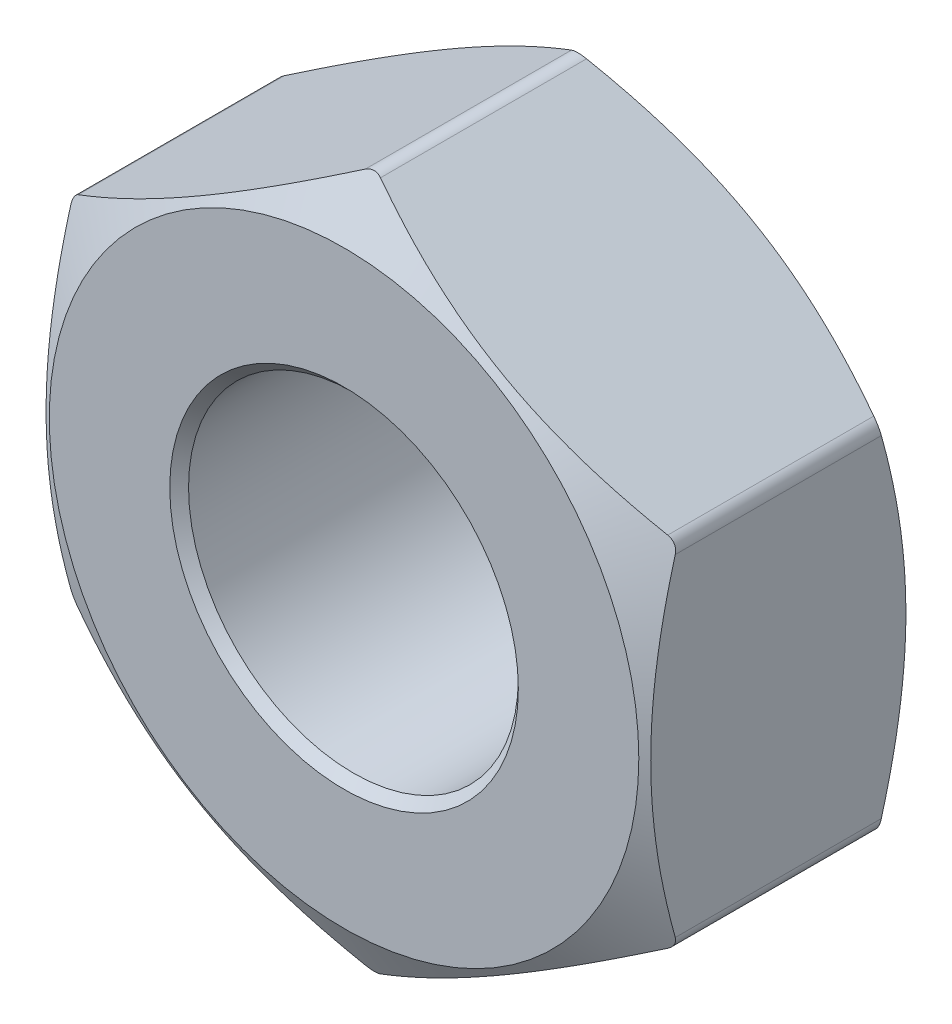
from build123d import *

# Parameters (mm, degrees)
BOSS_EXTRUDE1_DEPTH      = 1.2
BOSS_EXTRUDE1_DEPTH_BACK = 1.2
SKETCH2_R                = 1.5
SKETCH3_OUTSIDE_W        = 29.47
SKETCH3_OUTSIDE_H        = 30.32
SKETCH3_OUTSIDE_R        = 2.68125
CUT_EXTRUDE1_DEPTH       = 5.837957558
CUT_EXTRUDE1_DRAFT       = -60
FILLET1_R                = 0.1375
MIRROR1_COPY_1_SKETCH_W  = 29.47
MIRROR1_COPY_1_SKETCH_H  = 30.32
MIRROR1_COPY_1_SKETCH_R  = 2.68125
MIRROR1_COPY_1_DEPTH     = 5.837957558
MIRROR1_COPY_1_DRAFT     = -60


with BuildPart() as part:
    # Sketch2 → Boss-Extrude1 (new, two sides: drawn at the far end of the back side and taken through both)
    with BuildSketch(Plane.XY.offset(-BOSS_EXTRUDE1_DEPTH_BACK)):
        Polygon((0, 3.175426481), (-2.75, 1.58771324), (-2.75, -1.58771324), (0, -3.175426481), (2.75, -1.58771324), (2.75, 1.58771324), align=None)
        Circle(SKETCH2_R, mode=Mode.SUBTRACT)
    extrude(amount=BOSS_EXTRUDE1_DEPTH + BOSS_EXTRUDE1_DEPTH_BACK)


with BuildPart() as cut_extrude1_tool:
    # Sketch3 outside → Cut-Extrude1 (with draft: the straight prism first)
    with BuildSketch(Plane.XY.offset(1.2)):
        Rectangle(SKETCH3_OUTSIDE_W, SKETCH3_OUTSIDE_H)
        Circle(SKETCH3_OUTSIDE_R, mode=Mode.SUBTRACT)
    extrude(amount=-CUT_EXTRUDE1_DEPTH)
    # Cut-Extrude1: the draft: its side faces are tilted about the plane it starts from
    cut_extrude1_sides = [cut_extrude1_tool.faces().sort_by_distance(p)[0] for p in [
        (0, -15.16, -1.718978779),
        (14.735, 0, -1.718978779),
        (0, 15.16, -1.718978779),
        (-14.735, 0, -1.718978779),
        (-2.68125, 0, -1.718978779),
    ]]
    draft(cut_extrude1_sides, Plane.XY.offset(1.2), CUT_EXTRUDE1_DRAFT)


with BuildPart() as part_1:
    add(part.part)

    # Cut-Extrude1: cut by cut_extrude1_tool
    add(cut_extrude1_tool.part, mode=Mode.SUBTRACT)

    # Fillet1
    fillet1_edges = [part_1.edges().sort_by_distance(p)[0] for p in [
        (2.75, -1.58771324, -0.142656462),
        (0, -3.175426481, -0.142656462),
        (-2.75, -1.58771324, -0.142656462),
        (-2.75, 1.58771324, -0.142656462),
        (2.75, 1.58771324, -0.142656462),
        (0, 3.175426481, -0.142656462),
    ]]
    fillet(fillet1_edges, radius=FILLET1_R)

    # Cut-Extrude4 cone 1 section (through the dimple's axis) → Cut-Extrude4 (revolve, cut)
    with BuildSketch(Plane(origin=(0, 0, 1.2), x_dir=(0, -1, 0), z_dir=(1, 0, 0))):
        Polygon((0, 0), (1.585376588, 0), (0, 1.585376588), align=None)
    cut_extrude4 = revolve(axis=Axis((0, 0, 1.2), (0, 0, -1)), mode=Mode.SUBTRACT)

    # Mirror1: Cut-Extrude4 across plane
    add(cut_extrude4.mirror(Plane.XY), mode=Mode.SUBTRACT)


with BuildPart() as mirror1_copy_1_tool:
    # Mirror1 copy 1 sketch → Mirror1 copy 1 (with draft: the straight prism first)
    with BuildSketch(Plane(origin=(0, 0, -1.2), x_dir=(1, 0, 0), z_dir=(0, 0, -1))):
        Rectangle(MIRROR1_COPY_1_SKETCH_W, MIRROR1_COPY_1_SKETCH_H)
        Circle(MIRROR1_COPY_1_SKETCH_R, mode=Mode.SUBTRACT)
    extrude(amount=-MIRROR1_COPY_1_DEPTH)
    # Mirror1 copy 1: the draft: its side faces are tilted about the plane it starts from
    mirror1_copy_1_sides = [mirror1_copy_1_tool.faces().sort_by_distance(p)[0] for p in [
        (0, -15.16, 1.718978779),
        (14.735, 0, 1.718978779),
        (0, 15.16, 1.718978779),
        (-14.735, 0, 1.718978779),
        (-2.68125, 0, 1.718978779),
    ]]
    draft(mirror1_copy_1_sides, Plane(origin=(0, 0, -1.2), x_dir=(1, 0, 0), z_dir=(0, 0, -1)), MIRROR1_COPY_1_DRAFT)


with BuildPart() as part_2:
    add(part_1.part)

    # Mirror1 copy 1: cut by mirror1_copy_1_tool
    add(mirror1_copy_1_tool.part, mode=Mode.SUBTRACT)


solid = part_2.part
